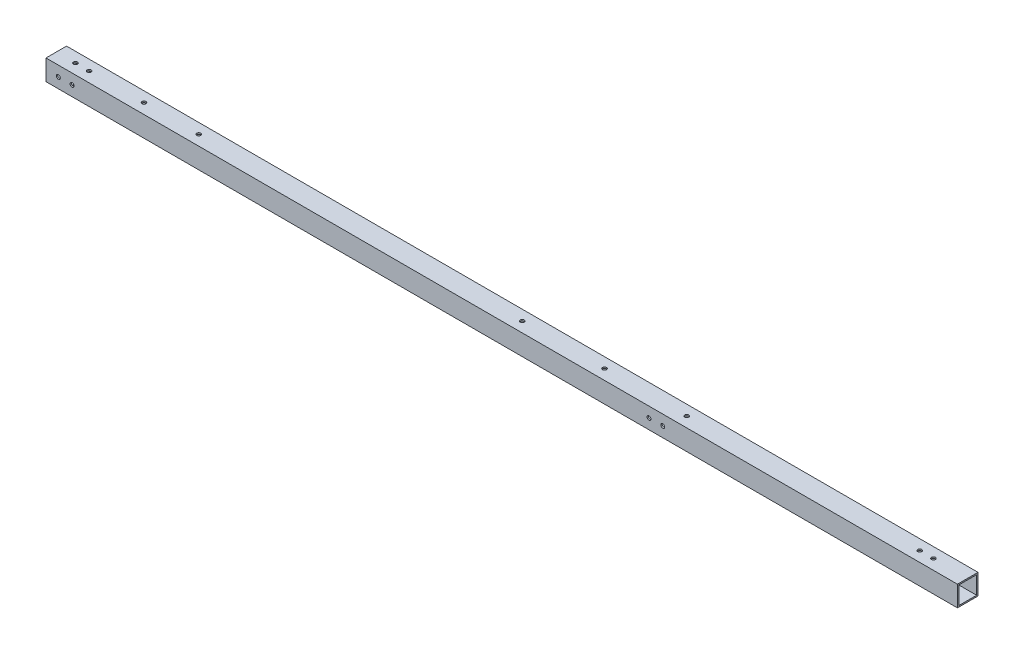
from build123d import *

# Parameters (mm, degrees)
SKETCH_1_W          = 15
SKETCH_1_H          = 15
SKETCH_1_W_2        = 13
SKETCH_1_H_2        = 13
EXTRUDE_1_DEPTH     = 665
SKETCH_3_R          = 1.45
CUT_EXTRUDE_1_DEPTH = 666.211432554
SKETCH_4_R          = 1.45
CUT_EXTRUDE_2_DEPTH = 666.211432554


with BuildPart() as part:
    # 草图1 → 凸台-拉伸1 (new body)
    with BuildSketch(Plane(origin=(0, 0, 0), x_dir=(0, 0, -1), z_dir=(1, 0, 0))):
        Rectangle(SKETCH_1_W, SKETCH_1_H)
        Rectangle(SKETCH_1_W_2, SKETCH_1_H_2, mode=Mode.SUBTRACT)
    extrude(amount=EXTRUDE_1_DEPTH)

    # 草图3 → 切除-拉伸1 (cut, through all)
    with BuildSketch(Plane(origin=(0, 0, -7.5), x_dir=(-1, 0, 0), z_dir=(0, 0, -1))):
        with Locations((-9, 0)):
            Circle(SKETCH_3_R)
        with Locations((-19, 0)):
            Circle(SKETCH_3_R)
        with Locations((-440, 0)):
            Circle(SKETCH_3_R)
        with Locations((-450, 0)):
            Circle(SKETCH_3_R)
    extrude(amount=-CUT_EXTRUDE_1_DEPTH, mode=Mode.SUBTRACT)

    # 草图4 → 切除-拉伸2 (cut, through all)
    with BuildSketch(Plane(origin=(0, 7.5, 0), x_dir=(1, 0, 0), z_dir=(0, 1, 0))):
        with Locations(Location((630, 0, 0), (0, 0, 270))):
            Circle(SKETCH_4_R)
        with Locations(Location((640, 0, 0), (0, 0, 270))):
            Circle(SKETCH_4_R)
        with Locations(Location((14, 0, 0), (0, 0, 270))):
            Circle(SKETCH_4_R)
        with Locations(Location((24, 0, 0), (0, 0, 270))):
            Circle(SKETCH_4_R)
        with Locations(Location((64, 0, 0), (0, 0, 270))):
            Circle(SKETCH_4_R)
        with Locations(Location((104, 0, 0), (0, 0, 270))):
            Circle(SKETCH_4_R)
        with Locations(Location((340, 0, 0), (0, 0, 270))):
            Circle(SKETCH_4_R)
        with Locations(Location((400, 0, 0), (0, 0, 270))):
            Circle(SKETCH_4_R)
        with Locations(Location((460, 0, 0), (0, 0, 270))):
            Circle(SKETCH_4_R)
    extrude(amount=-CUT_EXTRUDE_2_DEPTH, mode=Mode.SUBTRACT)


solid = part.part
